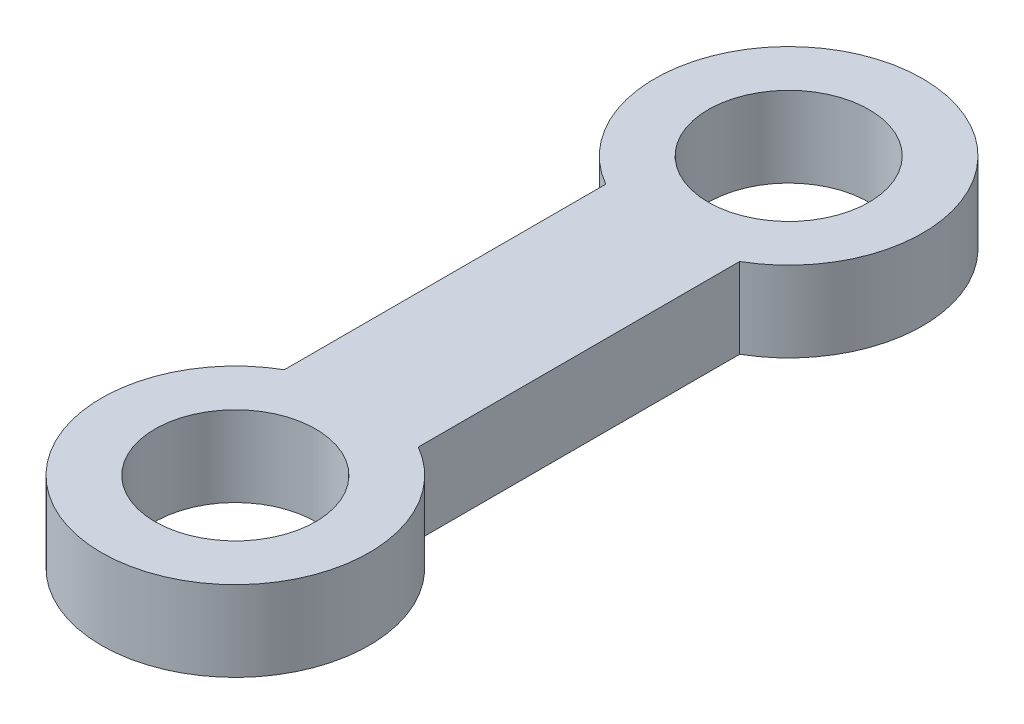
from build123d import *

# Parameters (mm, degrees)
SKETCH_2_R      = 5
SKETCH_2_R_2    = 3
SKETCH_2_W      = 5
SKETCH_2_H      = 12
EXTRUDE_1_DEPTH = 3


with BuildPart() as part:
    # 草图2 → 凸台-拉伸1 (new body)
    # profile 1 of 3: a face of its own
    with BuildSketch(Plane(origin=(0, 0, 0), x_dir=(1, 0, 0), z_dir=(0, 1, 0))):
        Circle(SKETCH_2_R)
        with Locations(Location((0, 0, 0), (0, 0, 270))):
            Circle(SKETCH_2_R_2, mode=Mode.SUBTRACT)
    # profile 2 of 3: a face of its own
    with BuildSketch(Plane(origin=(0, 0, 0), x_dir=(1, 0, 0), z_dir=(0, 1, 0))):
        with Locations((0, -20.660254038)):
            Circle(SKETCH_2_R)
        with Locations(Location((0, -20.660254038, 0), (0, 0, 270))):
            Circle(SKETCH_2_R_2, mode=Mode.SUBTRACT)
    # profile 3 of 3: a face of its own
    with BuildSketch(Plane(origin=(0, 0, 0), x_dir=(1, 0, 0), z_dir=(0, 1, 0))):
        with Locations((0, -10.330127019)):
            Rectangle(SKETCH_2_W, SKETCH_2_H)
    extrude(amount=EXTRUDE_1_DEPTH)


solid = part.part
